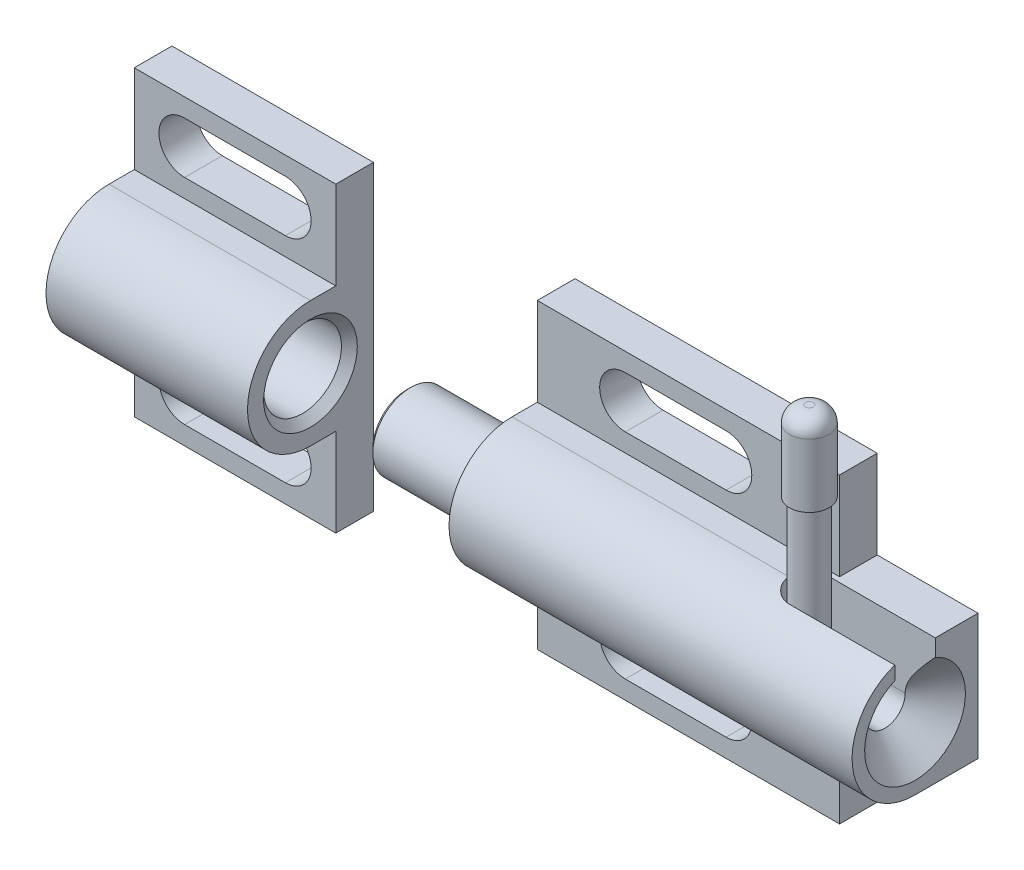
from build123d import *

# Parameters (mm, degrees)
BOSS_EXTRUDE1_DEPTH = 25.4
CUT_EXTRUDE2_REACH  = 37.498
BOSS_EXTRUDE2_DEPTH = 50.8
SKETCH5_W           = 4.7498
SKETCH5_H           = 11.1125
CUT_EXTRUDE3_DEPTH  = 12.7
CUT_EXTRUDE4_DEPTH  = 7.9375
CUT_EXTRUDE5_DEPTH  = 4.7498
SKETCH12_R          = 2


with BuildPart() as part:
    # Sketch1 → Boss-Extrude1 (new body)
    with BuildSketch(Plane(origin=(0, 0, 0), x_dir=(0, 0, -1), z_dir=(1, 0, 0))):
        with BuildLine():
            Line((0, -19.05), (0, 19.05))
            Line((0, 19.05), (-4.7498, 19.05))
            Line((-4.7498, 19.05), (-4.7498, 7.9375))
            Line((-4.7498, 7.9375), (-7.9375, 7.9375))
            ThreePointArc((-7.9375, 7.9375), (-15.875, 0), (-7.9375, -7.9375))
            Line((-7.9375, -7.9375), (-4.7498, -7.9375))
            Line((-4.7498, -7.9375), (-4.7498, -19.05))
            Line((-4.7498, -19.05), (0, -19.05))
        make_face()
    extrude(amount=-BOSS_EXTRUDE1_DEPTH)

    # Sketch2 → Cut-Revolve1 (revolve, cut)
    with BuildSketch(Plane(origin=(0, 0, 0), x_dir=(1, 0, 0), z_dir=(0, 1, 0)), mode=Mode.PRIVATE) as cut_revolve1_sk:
        Polygon((-25.4, -7.9375), (-25.4, -10.4902), (-19.05, -10.4902), (-19.05, -12.8397), (-1, -12.8397), (0, -13.8397), (0, -7.9375), align=None)
    revolve(cut_revolve1_sk.sketch.rotate(Axis((0, 0, 7.9375), (-1, 0, 0)), 180), axis=Axis((0, 0, 7.9375), (-1, 0, 0)), mode=Mode.SUBTRACT)

    # Sketch3 → Cut-Extrude2 (cut, up to next)
    with BuildSketch(Plane.XY, mode=Mode.PRIVATE) as cut_extrude2_sk1:
        with BuildLine():
            Line((-19.05, 16.7259), (-6.35, 16.7259))
            ThreePointArc((-6.35, 16.7259), (-3.1115, 13.4874), (-6.35, 10.2489))
            Line((-6.35, 10.2489), (-19.05, 10.2489))
            ThreePointArc((-19.05, 10.2489), (-22.2885, 13.4874), (-19.05, 16.7259))
        make_face()
    cut_extrude2_tool1 = extrude(cut_extrude2_sk1.sketch, amount=CUT_EXTRUDE2_REACH, mode=Mode.PRIVATE) & part.part
    # Sketch3 → Cut-Extrude2 (cut, up to next)
    with BuildSketch(Plane.XY, mode=Mode.PRIVATE) as cut_extrude2_sk2:
        with BuildLine():
            Line((-19.05, -16.7259), (-6.35, -16.7259))
            ThreePointArc((-6.35, -16.7259), (-3.1115, -13.4874), (-6.35, -10.2489))
            Line((-6.35, -10.2489), (-19.05, -10.2489))
            ThreePointArc((-19.05, -10.2489), (-22.2885, -13.4874), (-19.05, -16.7259))
        make_face()
    cut_extrude2_tool2 = extrude(cut_extrude2_sk2.sketch, amount=CUT_EXTRUDE2_REACH, mode=Mode.PRIVATE) & part.part
    add(cut_extrude2_tool1.solids().sort_by_distance((-12.7, 13.4874, 0))[0], mode=Mode.SUBTRACT)
    add(cut_extrude2_tool2.solids().sort_by_distance((-12.7, -13.4874, 0))[0], mode=Mode.SUBTRACT)


with BuildPart() as body_2:
    # Sketch4 → Boss-Extrude2 (new body)
    with BuildSketch(Plane(origin=(25.4, 0, 0), x_dir=(0, 0, -1), z_dir=(1, 0, 0))):
        with BuildLine():
            Line((0, -19.05), (0, 19.05))
            Line((0, 19.05), (-4.7498, 19.05))
            Line((-4.7498, 19.05), (-4.7498, 7.9375))
            Line((-4.7498, 7.9375), (-7.9375, 7.9375))
            ThreePointArc((-7.9375, 7.9375), (-15.875, 0), (-7.9375, -7.9375))
            Line((-7.9375, -7.9375), (-4.7498, -7.9375))
            Line((-4.7498, -7.9375), (-4.7498, -19.05))
            Line((-4.7498, -19.05), (0, -19.05))
        make_face()
    extrude(amount=BOSS_EXTRUDE2_DEPTH)

    # Sketch5 → Cut-Extrude3 (cut)
    with BuildSketch(Plane(origin=(76.2, 0, 0), x_dir=(0, 0, -1), z_dir=(1, 0, 0))):
        with Locations((-2.3749, 13.49375)):
            Rectangle(SKETCH5_W, SKETCH5_H)
        with Locations((-2.3749, -13.49375)):
            Rectangle(SKETCH5_W, SKETCH5_H)
    extrude(amount=-CUT_EXTRUDE3_DEPTH, mode=Mode.SUBTRACT)

    # Sketch6 → Cut-Revolve2 (revolve, cut)
    with BuildSketch(Plane(origin=(0, 0, 0), x_dir=(1, 0, 0), z_dir=(0, 1, 0))):
        Polygon((25.4, -7.9375), (25.4, -13.8397), (26.4, -12.8397), (57.15, -12.8397), (58.561722024, -10.4902), (72.4027, -10.4902), (76.2, -14.2875), (76.2, -7.9375), align=None)
    revolve(axis=Axis((25.4, 0, 7.9375), (1, 0, 0)), mode=Mode.SUBTRACT)

    # Sketch7 → Cut-Extrude4 (cut)
    with BuildSketch(Plane(origin=(0, 0, 0), x_dir=(1, 0, 0), z_dir=(0, 1, 0))):
        with BuildLine():
            Line((62.87516, -10.4902), (76.2, -10.4902))
            Line((76.2, -10.4902), (76.2, -5.3848))
            Line((76.2, -5.3848), (62.87516, -5.3848))
            ThreePointArc((62.87516, -5.3848), (60.32246, -7.9375), (62.87516, -10.4902))
        make_face()
    extrude(amount=CUT_EXTRUDE4_DEPTH, mode=Mode.SUBTRACT)

    # Sketch8 → Cut-Extrude5 (cut)
    with BuildSketch(Plane.XY):
        with BuildLine():
            Line((36.4998, 16.7259), (49.1998, 16.7259))
            ThreePointArc((49.1998, 16.7259), (52.4383, 13.4874), (49.1998, 10.2489))
            Line((49.1998, 10.2489), (36.4998, 10.2489))
            ThreePointArc((36.4998, 10.2489), (33.2613, 13.4874), (36.4998, 16.7259))
        make_face()
        with BuildLine():
            Line((36.4998, -16.7259), (49.1998, -16.7259))
            ThreePointArc((49.1998, -16.7259), (52.4383, -13.4874), (49.1998, -10.2489))
            Line((49.1998, -10.2489), (36.4998, -10.2489))
            ThreePointArc((36.4998, -10.2489), (33.2613, -13.4874), (36.4998, -16.7259))
        make_face()
    extrude(amount=CUT_EXTRUDE5_DEPTH, mode=Mode.SUBTRACT)


with BuildPart() as body_3:
    # Sketch9 → Revolve1 (revolve)
    with BuildSketch(Plane.XY.offset(7.9375), mode=Mode.PRIVATE) as revolve1_sk:
        Polygon((12.12516, 0), (12.12516, 4.2625), (12.62516, 4.7625), (41.62516, 4.7625), (41.62516, 2), (60.37516, 2), (60.37516, 0), align=None)
    revolve(revolve1_sk.sketch.rotate(Axis((12.12516, 0, 7.9375), (1, 0, 0)), 90), axis=Axis((12.12516, 0, 7.9375), (1, 0, 0)))



with BuildPart() as body_4:
    # Sketch11 → Revolve2 (revolve)
    with BuildSketch(Plane.XY.offset(7.9375), mode=Mode.PRIVATE) as revolve2_sk:
        with BuildLine():
            Line((60.87516, 2.5), (60.87516, 18))
            Line((60.87516, 18), (60.37516, 18))
            Line((60.37516, 18), (60.37516, 26))
            ThreePointArc((60.37516, 26), (60.960946438, 27.414213562), (62.37516, 28))
            Line((62.37516, 28), (62.87516, 28))
            Line((62.87516, 28), (62.87516, 2.5))
            Line((62.87516, 2.5), (60.87516, 2.5))
        make_face()
    revolve(revolve2_sk.sketch.rotate(Axis((62.87516, 2.5, 7.9375), (0, 1, 0)), 180), axis=Axis((62.87516, 2.5, 7.9375), (0, 1, 0)))


with BuildPart() as body_3_1:
    add(body_3.part)

    add(body_4.part)  # Sweep1 merges body 4
    # Sweep1: sweep along a path in Sketch13
    with BuildLine(Plane.XY.offset(7.9375)) as sweep1_path:
        ThreePointArc((60.37516, 0), (62.142926953, 0.732233047), (62.87516, 2.5))
    # Sketch12 → Sweep1 (sweep)
    with BuildSketch(Plane(origin=(60.37516, 0, 0), x_dir=(0, 0, -1), z_dir=(1, 0, 0))):
        with Locations((-7.9375, 0)):
            Circle(SKETCH12_R)
    sweep(path=sweep1_path.line)


solid = Compound([part.part, body_2.part, body_3_1.part])
